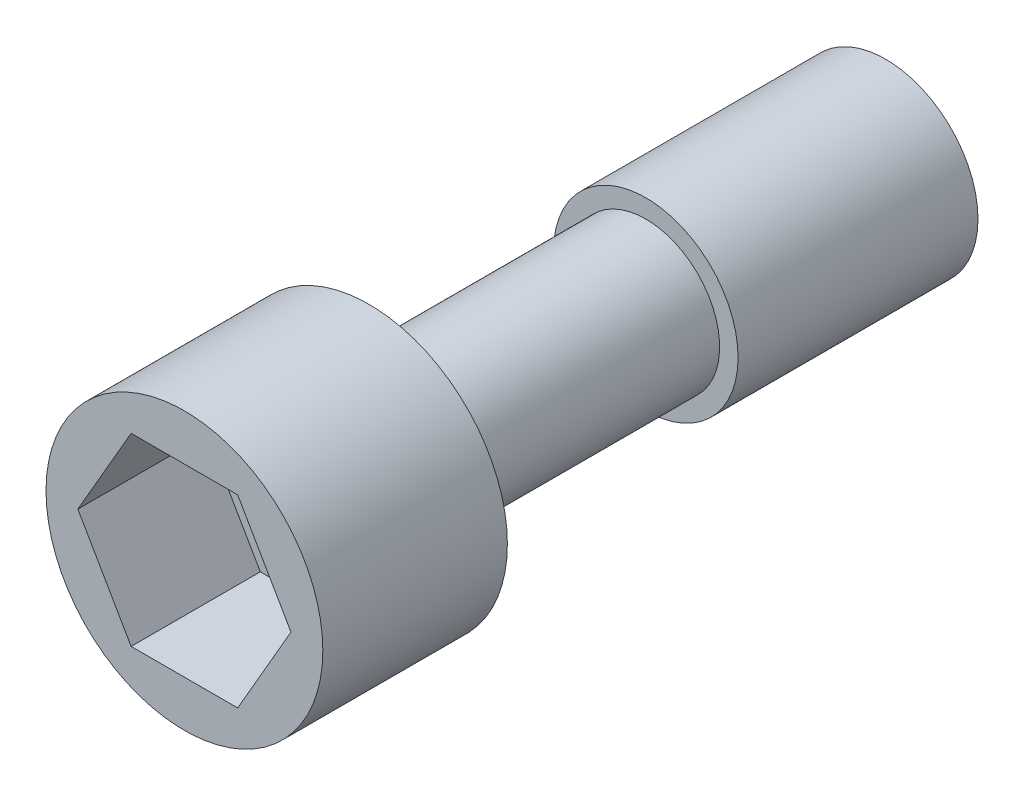
from build123d import *

# Parameters (mm, degrees)
SKETCH1_R               = 7.5
BOSS_EXTRUDE1_DEPTH     = 10
SKETCH2_R               = 4
BOSS_EXTRUDE2_DEPTH     = 15
SKETCH3_R               = 5
BOSS_EXTRUDE3_DEPTH     = 13
CUT_EXTRUDE1_DEPTH      = 40.452503089
CUT_EXTRUDE1_DEPTH_BACK = 7


with BuildPart() as part:
    # Sketch1 → Boss-Extrude1 (new body)
    with BuildSketch(Plane.XY):
        Circle(SKETCH1_R)
    extrude(amount=BOSS_EXTRUDE1_DEPTH)

    # Sketch2 → Boss-Extrude2 (add)
    with BuildSketch(Plane(origin=(0, 0, 0), x_dir=(-1, 0, 0), z_dir=(0, 0, -1))):
        Circle(SKETCH2_R)
    extrude(amount=BOSS_EXTRUDE2_DEPTH)

    # Sketch3 → Boss-Extrude3 (add)
    with BuildSketch(Plane(origin=(0, 0, -15), x_dir=(-1, 0, 0), z_dir=(0, 0, -1))):
        with Locations(Location((0, 0, 0), (0, 0, 180))):
            Circle(SKETCH3_R)
    extrude(amount=BOSS_EXTRUDE3_DEPTH)

    # Sketch4 → Cut-Extrude1 (cut, two sides: drawn at the far end of the back side and taken through both)
    with BuildSketch(Plane.XY.offset(10).offset(-CUT_EXTRUDE1_DEPTH_BACK)):
        Polygon((5.773502692, 0), (2.886751346, 5), (-2.886751346, 5), (-5.773502692, 0), (-2.886751346, -5), (2.886751346, -5), align=None)
    extrude(amount=CUT_EXTRUDE1_DEPTH + CUT_EXTRUDE1_DEPTH_BACK, mode=Mode.SUBTRACT)


solid = part.part
